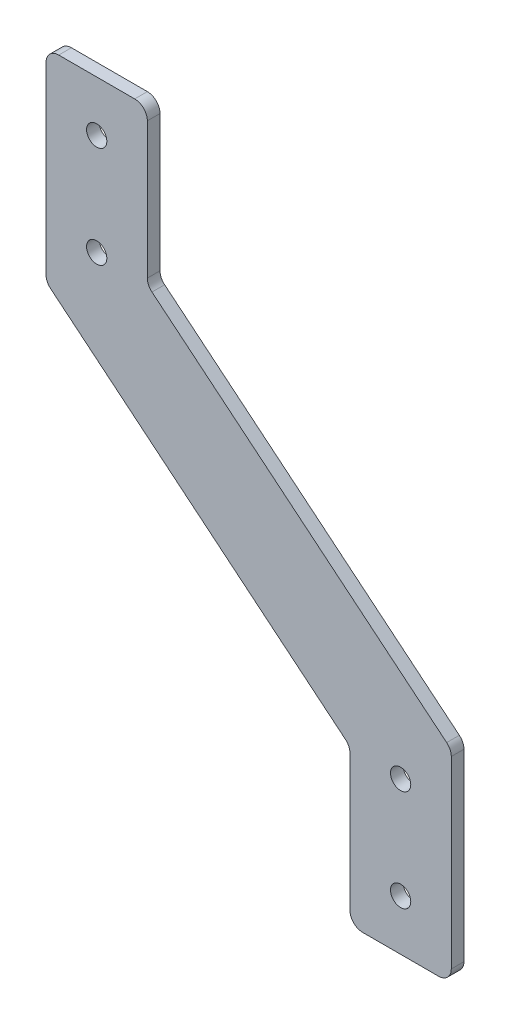
from build123d import *

# Parameters (mm, degrees)
SKETCH1_R           = 2.54
BOSS_EXTRUDE1_DEPTH = 3.175
FILLET1_R           = 3.175


with BuildPart() as part:
    # Sketch1 → Boss-Extrude1 (new body)
    with BuildSketch(Plane.XY):
        Polygon((-12.7, -12.7), (12.7, -12.7), (12.7, 38.1), (-63.5, 100.883206633), (-63.5, 139.7), (-88.9, 139.7), (-88.9, 88.9), (-12.7, 26.116793367), align=None)
        with Locations((0, 25.4)):
            Circle(SKETCH1_R, mode=Mode.SUBTRACT)
        Circle(SKETCH1_R, mode=Mode.SUBTRACT)
        with Locations((-76.2, 127)):
            Circle(SKETCH1_R, mode=Mode.SUBTRACT)
        with Locations((-76.2, 101.6)):
            Circle(SKETCH1_R, mode=Mode.SUBTRACT)
    extrude(amount=BOSS_EXTRUDE1_DEPTH)

    # Fillet1
    fillet1_edges = [part.edges().sort_by_distance(p)[0] for p in [
        (-88.9, 88.9, 1.5875),
        (-88.9, 139.7, 1.5875),
        (-63.5, 139.7, 1.5875),
        (-63.5, 100.883206633, 1.5875),
        (12.7, 38.1, 1.5875),
        (12.7, -12.7, 1.5875),
        (-12.7, -12.7, 1.5875),
        (-12.7, 26.116793367, 1.5875),
    ]]
    fillet(fillet1_edges, radius=FILLET1_R)


solid = part.part
